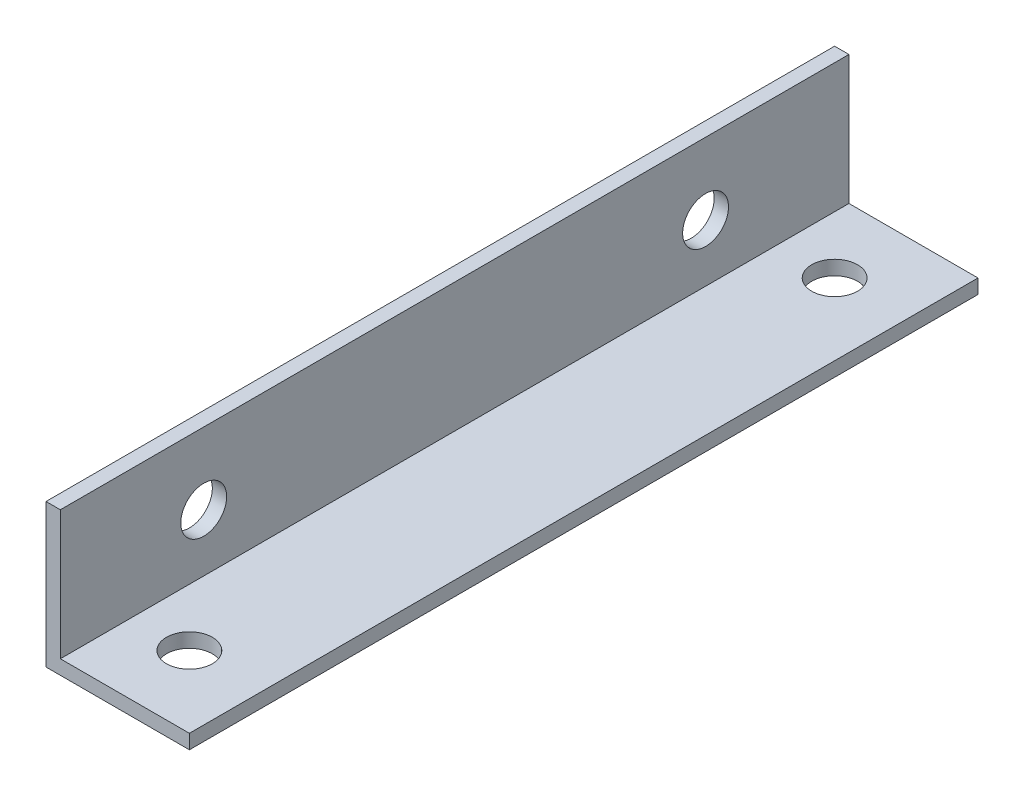
from build123d import *

# Parameters (mm, degrees)
EXTRUDE_1_DEPTH     = 55
SKETCH_2_R          = 1.6
CUT_EXTRUDE_1_DEPTH = 57.124860802
SKETCH_3_R          = 1.6
CUT_EXTRUDE_2_DEPTH = 57.124860802


with BuildPart() as part:
    # ｽｹｯﾁ1 → ﾎﾞｽ - 押し出し1 (new body)
    with BuildSketch(Plane.XY):
        Polygon((-4, 5), (-4, -4), (5, -4), (5, -5), (-5, -5), (-5, 5), align=None)
    extrude(amount=EXTRUDE_1_DEPTH)

    # ｽｹｯﾁ2 → ｶｯﾄ - 押し出し1 (cut, through all)
    with BuildSketch(Plane.XZ.offset(5)):
        with Locations((0, 5)):
            Circle(SKETCH_2_R)
        with Locations((0, 50)):
            Circle(SKETCH_2_R)
    extrude(amount=-CUT_EXTRUDE_1_DEPTH, mode=Mode.SUBTRACT)

    # ｽｹｯﾁ3 → ｶｯﾄ - 押し出し2 (cut, through all)
    with BuildSketch(Plane.ZY.offset(5)):
        with Locations((10, 0)):
            Circle(SKETCH_3_R)
        with Locations((45, 0)):
            Circle(SKETCH_3_R)
    extrude(amount=-CUT_EXTRUDE_2_DEPTH, mode=Mode.SUBTRACT)


solid = part.part
